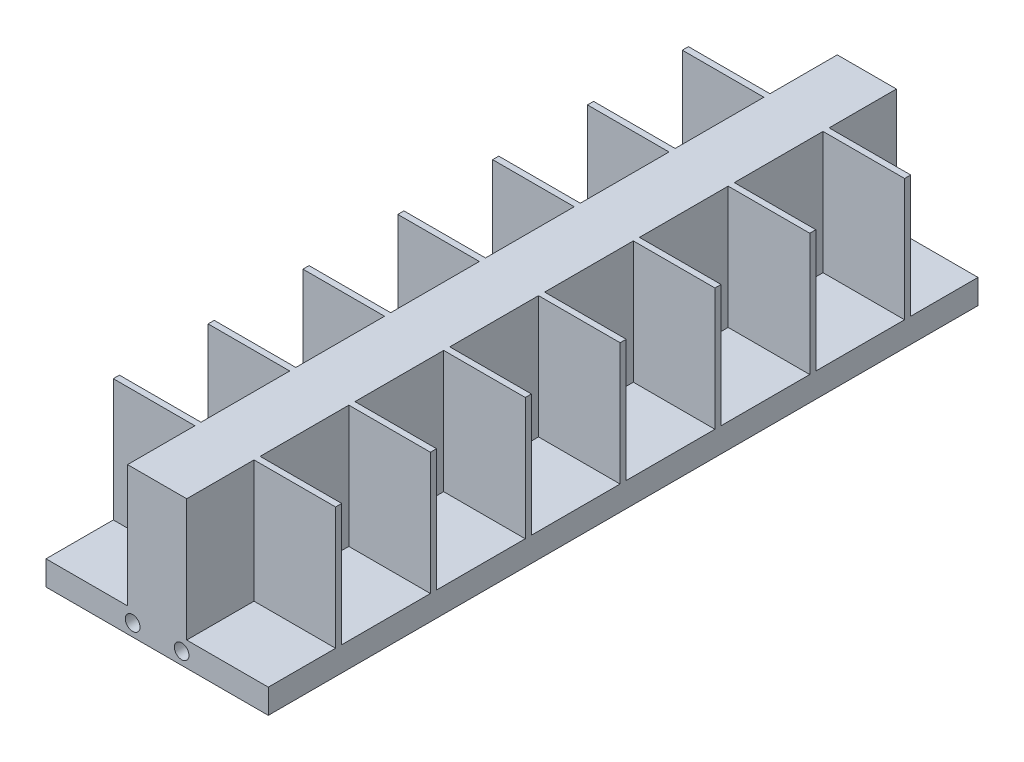
from build123d import *

# Parameters (mm, degrees)
LEG_DEPTH               = 87
SKETCH5_W               = 20
SKETCH5_H               = 21.25
CELL_SLOTS_DEPTH        = 30
SKETCH6_W               = 20
SKETCH6_H               = 0.25
CELL_SLOTS_TRIM_DEPTH   = 30
SKETCH7_R               = 1.8
SCREW_HOLES_FRONT_DEPTH = 10


with BuildPart() as part:
    # Sketch1 → Leg (new, symmetric)
    with BuildSketch(Plane.XY):
        Polygon((0, -6), (0, 0), (0, 30), (-54.5, 30), (-54.5, -6), align=None)
    extrude(amount=LEG_DEPTH, both=True)

    # Sketch5 → Cell Slots (cut)
    with BuildSketch(Plane(origin=(0, 30, 0), x_dir=(1, 0, 0), z_dir=(0, 1, 0))):
        with Locations((-10, -81.375)):
            Rectangle(SKETCH5_W, SKETCH5_H)
        with Locations((-10, -58.125)):
            Rectangle(SKETCH5_W, SKETCH5_H)
        with Locations((-10, -34.875)):
            Rectangle(SKETCH5_W, SKETCH5_H)
        with Locations((-10, -11.625)):
            Rectangle(SKETCH5_W, SKETCH5_H)
        with Locations((-10, 11.625)):
            Rectangle(SKETCH5_W, SKETCH5_H)
        with Locations((-10, 34.875)):
            Rectangle(SKETCH5_W, SKETCH5_H)
        with Locations((-10, 58.125)):
            Rectangle(SKETCH5_W, SKETCH5_H)
        with Locations((-10, 81.375)):
            Rectangle(SKETCH5_W, SKETCH5_H)
        with Locations((-44.5, -81.375)):
            Rectangle(SKETCH5_W, SKETCH5_H)
        with Locations((-44.5, -58.125)):
            Rectangle(SKETCH5_W, SKETCH5_H)
        with Locations((-44.5, -34.875)):
            Rectangle(SKETCH5_W, SKETCH5_H)
        with Locations((-44.5, -11.625)):
            Rectangle(SKETCH5_W, SKETCH5_H)
        with Locations((-44.5, 11.625)):
            Rectangle(SKETCH5_W, SKETCH5_H)
        with Locations((-44.5, 34.875)):
            Rectangle(SKETCH5_W, SKETCH5_H)
        with Locations((-44.5, 58.125)):
            Rectangle(SKETCH5_W, SKETCH5_H)
        with Locations((-44.5, 81.375)):
            Rectangle(SKETCH5_W, SKETCH5_H)
    extrude(amount=-CELL_SLOTS_DEPTH, mode=Mode.SUBTRACT)

    # Sketch6 → Cell Slots Trim (cut)
    with BuildSketch(Plane(origin=(0, 30, 0), x_dir=(1, 0, 0), z_dir=(0, 1, 0))):
        with Locations((-10, -70.625)):
            Rectangle(SKETCH6_W, SKETCH6_H)
        with Locations((-10, -68.875)):
            Rectangle(SKETCH6_W, SKETCH6_H)
        with Locations((-10, -47.375)):
            Rectangle(SKETCH6_W, SKETCH6_H)
        with Locations((-10, -45.625)):
            Rectangle(SKETCH6_W, SKETCH6_H)
        with Locations((-10, -24.125)):
            Rectangle(SKETCH6_W, SKETCH6_H)
        with Locations((-10, -22.375)):
            Rectangle(SKETCH6_W, SKETCH6_H)
        with Locations((-10, -0.875)):
            Rectangle(SKETCH6_W, SKETCH6_H)
        with Locations((-10, 0.875)):
            Rectangle(SKETCH6_W, SKETCH6_H)
        with Locations((-10, 22.375)):
            Rectangle(SKETCH6_W, SKETCH6_H)
        with Locations((-10, 24.125)):
            Rectangle(SKETCH6_W, SKETCH6_H)
        with Locations((-10, 45.625)):
            Rectangle(SKETCH6_W, SKETCH6_H)
        with Locations((-10, 47.375)):
            Rectangle(SKETCH6_W, SKETCH6_H)
        with Locations((-10, 68.875)):
            Rectangle(SKETCH6_W, SKETCH6_H)
        with Locations((-10, 70.625)):
            Rectangle(SKETCH6_W, SKETCH6_H)
        with Locations((-44.5, 70.625)):
            Rectangle(SKETCH6_W, SKETCH6_H)
        with Locations((-44.5, 68.875)):
            Rectangle(SKETCH6_W, SKETCH6_H)
        with Locations((-44.5, 47.375)):
            Rectangle(SKETCH6_W, SKETCH6_H)
        with Locations((-44.5, 45.625)):
            Rectangle(SKETCH6_W, SKETCH6_H)
        with Locations((-44.5, 24.125)):
            Rectangle(SKETCH6_W, SKETCH6_H)
        with Locations((-44.5, 22.375)):
            Rectangle(SKETCH6_W, SKETCH6_H)
        with Locations((-44.5, 0.875)):
            Rectangle(SKETCH6_W, SKETCH6_H)
        with Locations((-44.5, -0.875)):
            Rectangle(SKETCH6_W, SKETCH6_H)
        with Locations((-44.5, -22.375)):
            Rectangle(SKETCH6_W, SKETCH6_H)
        with Locations((-44.5, -24.125)):
            Rectangle(SKETCH6_W, SKETCH6_H)
        with Locations((-44.5, -45.625)):
            Rectangle(SKETCH6_W, SKETCH6_H)
        with Locations((-44.5, -47.375)):
            Rectangle(SKETCH6_W, SKETCH6_H)
        with Locations((-44.5, -68.875)):
            Rectangle(SKETCH6_W, SKETCH6_H)
        with Locations((-44.5, -70.625)):
            Rectangle(SKETCH6_W, SKETCH6_H)
    extrude(amount=-CELL_SLOTS_TRIM_DEPTH, mode=Mode.SUBTRACT)

    # Sketch7 → Screw Holes Front (cut)
    with BuildSketch(Plane.XY.offset(87)):
        with Locations((-33.25, -3)):
            Circle(SKETCH7_R)
        with Locations((-21.25, -3)):
            Circle(SKETCH7_R)
    screw_holes_front = extrude(amount=-SCREW_HOLES_FRONT_DEPTH, mode=Mode.SUBTRACT)

    # Screw Holes Back: Screw Holes Front across plane
    add(screw_holes_front.mirror(Plane(origin=(0, 0, 0), x_dir=(1, 0, 0), z_dir=(0, 0, -1))), mode=Mode.SUBTRACT)


solid = part.part
